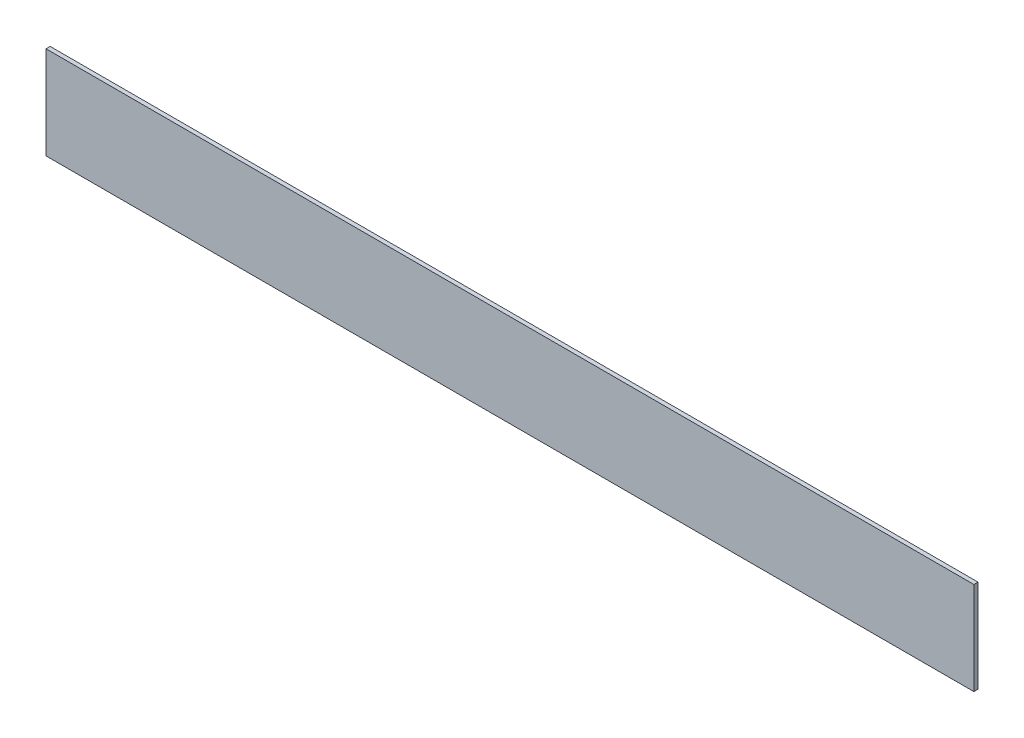
from build123d import *

# Parameters (mm, degrees)
SKETCH1_W           = 450
SKETCH1_H           = 45
BOSS_EXTRUDE1_DEPTH = 2


with BuildPart() as part:
    # Sketch1 → Boss-Extrude1 (new body)
    with BuildSketch(Plane.XY):
        Rectangle(SKETCH1_W, SKETCH1_H)
    extrude(amount=BOSS_EXTRUDE1_DEPTH)


solid = part.part
